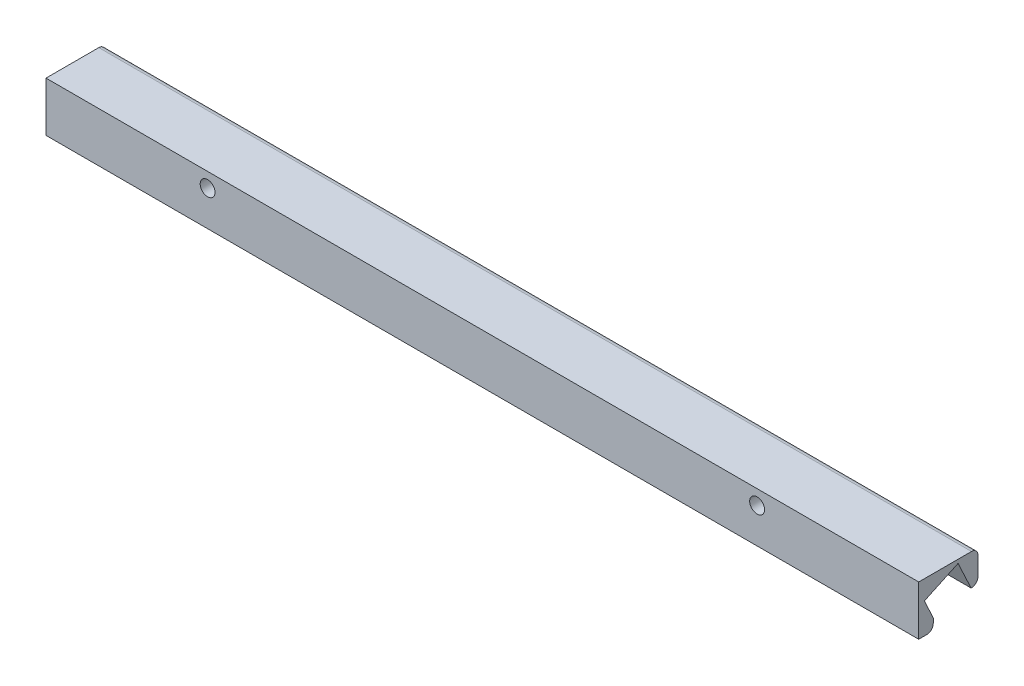
from build123d import *

# Parameters (mm, degrees)
PROFILEBOSS_EXTRUDE1_DEPTH           = 270
SKETCH2_R                            = 2.3
LEDSTRIPMOUNTHOLESCUT_EXTRUDE1_DEPTH = 4.5
SKETCH3_R                            = 2.3
MOUNTINGHOLESCUT_EXTRUDE3_DEPTH      = 4.5
SKETCH4_W                            = 28
SKETCH4_H                            = 11.5
POWERCONNECTORCUT_EXTRUDE4_DEPTH     = 6.5


with BuildPart() as part:
    # Sketch1 → ProfileBoss-Extrude1 (new body)
    with BuildSketch(Plane(origin=(0, 0, 0), x_dir=(0, 0, -1), z_dir=(1, 0, 0))):
        with BuildLine():
            Line((0, 0), (2.499461553, 0))
            ThreePointArc((2.499461553, 0), (3.914055855, 0.585944145), (4.5, 2.000538447))
            Line((4.5, 2.000538447), (4.5, 3.5))
            Line((4.5, 3.5), (14.922539551, 8.36011001))
            Line((14.922539551, 8.36011001), (16.190394336, 5.641186649))
            ThreePointArc((16.190394336, 5.641186649), (17.700753359, 6.16912635), (18.340729536, 7.635528477))
            Line((18.340729536, 7.635528477), (18.340729536, 13.36011001))
            ThreePointArc((18.340729536, 13.36011001), (17.754943098, 14.774323572), (16.340729536, 15.36011001))
            Line((16.340729536, 15.36011001), (0, 15.36011001))
            Line((0, 15.36011001), (0, 0))
        make_face()
    extrude(amount=PROFILEBOSS_EXTRUDE1_DEPTH)

    # Sketch2 → LedStripMountHolesCut-Extrude1 (cut)
    with BuildSketch(Plane(origin=(0, 1.15127832, 0.536849897), x_dir=(1, 0, 0), z_dir=(0, -0.906307787036651, -0.4226182617406973))):
        with Locations(Location((36.15, -9.494933384, 0), (0, 0, 270))):
            Circle(SKETCH2_R)
        with Locations(Location((233.85, -11.307548958, 0), (0, 0, 270))):
            Circle(SKETCH2_R)
    extrude(amount=-LEDSTRIPMOUNTHOLESCUT_EXTRUDE1_DEPTH, mode=Mode.SUBTRACT)

    # Sketch3 → MountingHolesCut-Extrude3 (cut)
    with BuildSketch(Plane.XY):
        with Locations((50, 10.86011001)):
            Circle(SKETCH3_R)
        with Locations((220, 10.86011001)):
            Circle(SKETCH3_R)
    extrude(amount=-MOUNTINGHOLESCUT_EXTRUDE3_DEPTH, mode=Mode.SUBTRACT)

    # Sketch4 → PowerConnectorCut-Extrude4 (cut)
    with BuildSketch(Plane(origin=(0, 1.15127832, 0.536849897), x_dir=(1, 0, 0), z_dir=(0, -0.906307787036651, -0.4226182617406973))):
        with Locations((256, -11.307548958)):
            Rectangle(SKETCH4_W, SKETCH4_H)
        with Locations((14, -11.307548958)):
            Rectangle(SKETCH4_W, SKETCH4_H)
    extrude(amount=-POWERCONNECTORCUT_EXTRUDE4_DEPTH, mode=Mode.SUBTRACT)


solid = part.part
